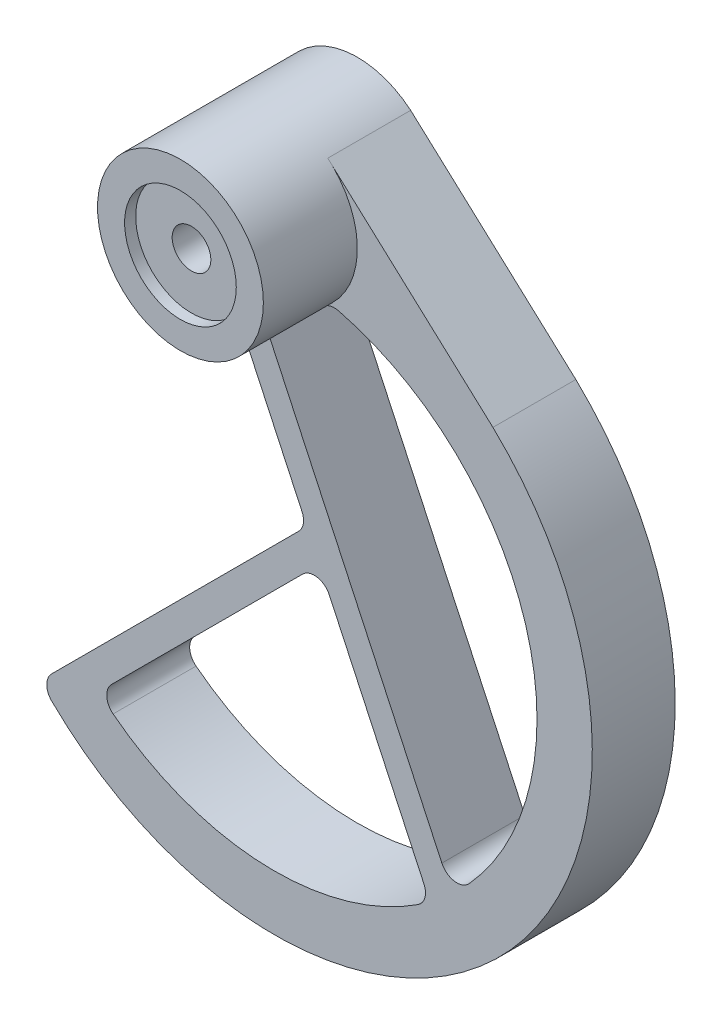
from build123d import *

# Parameters (mm, degrees)
EXTRUDE_1_DEPTH     = 15
SKETCH_6_R          = 3.5
CUT_EXTRUDE_2_DEPTH = 15
SKETCH_9_R          = 15
SKETCH_9_R_2        = 3.5
EXTRUDE_2_DEPTH     = 17
SKETCH_10_R         = 10.1
CUT_EXTRUDE_5_DEPTH = 2


with BuildPart() as part:
    # ｽｹｯﾁ1 → ﾎﾞｽ - 押し出し1 (new body)
    with BuildSketch(Plane.XY):
        with BuildLine():
            Line((10.546944731, 68.165925034), (9.641814145, 68.990666647))
            ThreePointArc((9.641814145, 68.990666647), (-9.131421435, 69.400300104), (-13.594616806, 51.160726074))
            Line((-13.594616806, 51.160726074), (4.986432096, 11.313538113))
            ThreePointArc((4.986432096, 11.313538113), (5.221931994, 9.524738795), (4.388829079, 7.924362985))
            Line((4.388829079, 7.924362985), (-40.303464689, -36.767930783))
            ThreePointArc((-40.303464689, -36.767930783), (-41.182112782, -38.903012739), (-40.283913759, -41.029943849))
            ThreePointArc((-40.283913759, -41.029943849), (41.397896806, -39.905690573), (39.524106652, 41.762363359))
            Line((39.524106652, 41.762363359), (37.916838192, 43.226882625))
            Line((37.916838192, 43.226882625), (10.546944731, 68.165925034))
        make_face()
        with BuildLine():
            ThreePointArc((5.093338956, 1.55780505), (7.735603832, 2.390907965), (9.933582661, 0.704339492))
            Line((9.933582661, 0.704339492), (27.046217634, -35.993824637))
            ThreePointArc((27.046217634, -35.993824637), (27.212084573, -38.085077821), (25.967336583, -39.773702754))
            ThreePointArc((25.967336583, -39.773702754), (-1.972837213, -47.459012983), (-29.17877254, -37.481318454))
            ThreePointArc((-29.17877254, -37.481318454), (-30.330146685, -35.299826939), (-29.457223039, -32.992756945))
            Line((-29.457223039, -32.992756945), (5.093338956, 1.55780505))
        make_face(mode=Mode.SUBTRACT)
        with BuildLine():
            ThreePointArc((35.231836325, -31.858557864), (32.560090836, -32.813013733), (30.287744354, -31.114293205))
            Line((30.287744354, -31.114293205), (-2.054746852, 38.244403012))
            ThreePointArc((-2.054746852, 38.244403012), (-1.895310582, 41.077194163), (0.553480425, 42.510214831))
            ThreePointArc((0.553480425, 42.510214831), (5.039223996, 43.371793408), (9.057681155, 45.543478261))
            ThreePointArc((9.057681155, 45.543478261), (10.270904088, 46.091905397), (11.601973614, 46.061309233))
            ThreePointArc((11.601973614, 46.061309233), (45.455779175, 13.784851815), (35.231836325, -31.858557864))
        make_face(mode=Mode.SUBTRACT)
    extrude(amount=EXTRUDE_1_DEPTH)

    # ｽｹｯﾁ6 → ｶｯﾄ - 押し出し2 (cut)
    with BuildSketch(Plane.XY.offset(15)):
        with Locations((0, 57.5)):
            Circle(SKETCH_6_R)
    extrude(amount=-CUT_EXTRUDE_2_DEPTH, mode=Mode.SUBTRACT)

    # ｽｹｯﾁ9 → ﾎﾞｽ - 押し出し2 (add)
    with BuildSketch(Plane.XY.offset(15)):
        with Locations(Location((0, 57.5, 0), (0, 0, 205))):
            Circle(SKETCH_9_R)
        with Locations((0, 57.5)):
            Circle(SKETCH_9_R_2, mode=Mode.SUBTRACT)
    extrude(amount=EXTRUDE_2_DEPTH)

    # ｽｹｯﾁ10 → ｶｯﾄ - 押し出し5 (cut)
    with BuildSketch(Plane.XY.offset(32)):
        with Locations((0, 57.5)):
            Circle(SKETCH_10_R)
    extrude(amount=-CUT_EXTRUDE_5_DEPTH, mode=Mode.SUBTRACT)


solid = part.part
